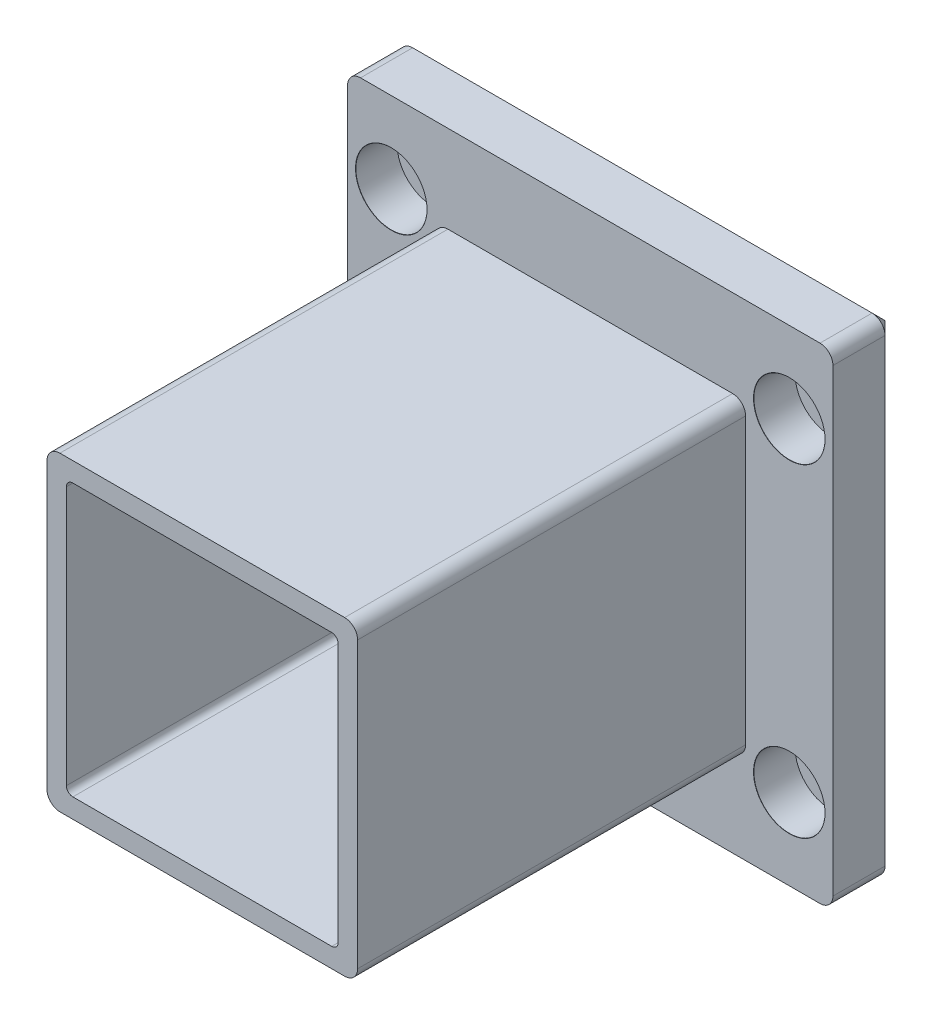
from build123d import *

# Parameters (mm, degrees)
SKETCH1_W                                    = 48
SKETCH1_H                                    = 48
SKETCH1_W_2                                  = 42
SKETCH1_H_2                                  = 42
BOSS_EXTRUDE1_DEPTH                          = 65
SKETCH3_W                                    = 75
SKETCH3_H                                    = 75
BOSS_EXTRUDE2_DEPTH                          = 5
SKETCH8_W                                    = 75
SKETCH8_H                                    = 75
SKETCH8_W_2                                  = 42
SKETCH8_H_2                                  = 42
BOSS_EXTRUDE3_DEPTH                          = 5.047079132
FILLET1_R                                    = 2
CBORE_FOR_M6_HEX_SOCKET_HEAD_CAP_SCR_2_COUNT = 2
CBORE_FOR_M6_HEX_SOCKET_HEAD_CAP_SCR_2_PITCH = 50
CBORE_FOR_M6_HEX_SOCKET_HEAD_CAP_SCR_3_COUNT = 2
CBORE_FOR_M6_HEX_SOCKET_HEAD_CAP_SCR_3_PITCH = 61.5
CBORE_FOR_M6_HEX_SOCKET_HEAD_CAP_SCR_4_COUNT = 2
CBORE_FOR_M6_HEX_SOCKET_HEAD_CAP_SCR_4_PITCH = 79.260645973
FILLET2_R                                    = 1
CHAMFER1_SIZE                                = 2


with BuildPart() as part:
    # Sketch1 → Boss-Extrude1 (new body)
    with BuildSketch(Plane(origin=(0, 0, 0), x_dir=(0, 1, 0), z_dir=(0, 0, 1))):
        with Locations((-1.048003873, 6.146094376)):
            Rectangle(SKETCH1_W, SKETCH1_H)
        with Locations((-1.048003873, 6.146094376)):
            Rectangle(SKETCH1_W_2, SKETCH1_H_2, mode=Mode.SUBTRACT)
    extrude(amount=BOSS_EXTRUDE1_DEPTH)

    # Sketch3 → Boss-Extrude2 (add)
    with BuildSketch(Plane(origin=(0, 0, 0), x_dir=(1, 0, 0), z_dir=(0, 0, -1))):
        with Locations((-6.146094376, 1.048003873)):
            Rectangle(SKETCH3_W, SKETCH3_H)
    extrude(amount=BOSS_EXTRUDE2_DEPTH)

    # Sketch8 → Boss-Extrude3 (add)
    with BuildSketch(Plane.XY):
        with Locations((-6.146094376, -1.048003873)):
            Rectangle(SKETCH8_W, SKETCH8_H)
        with Locations((-6.146094376, -1.048003873)):
            Rectangle(SKETCH8_W_2, SKETCH8_H_2, mode=Mode.SUBTRACT)
    extrude(amount=BOSS_EXTRUDE3_DEPTH)

    # Fillet1
    fillet1_edges = [part.edges().sort_by_distance(p)[0] for p in [
        (17.853905624, 22.951996127, 35.023539566),
        (17.853905624, -25.048003873, 35.023539566),
        (-30.146094376, -25.048003873, 35.023539566),
        (-30.146094376, 22.951996127, 35.023539566),
        (-43.646094376, -38.548003873, 0.023539566),
        (31.353905624, -38.548003873, 0.023539566),
        (31.353905624, 36.451996127, 0.023539566),
        (-43.646094376, 36.451996127, 0.023539566),
    ]]
    fillet(fillet1_edges, radius=FILLET1_R)

    # Sketch15 → CBORE for M6 Hex Socket Head Cap Screw2 (revolve, cut)
    with BuildSketch(Plane(origin=(-36.896094376, 23.951996127, 5.047079132), x_dir=(0, -1, 0), z_dir=(1, 0, 0))):
        Polygon((0, 0), (0, 10.047079132), (3.3, 10.047079132), (3.3, 6.4), (5.5, 6.4), (5.5, 0.025), (5.525, 0), align=None)
    cbore_for_m6_hex_socket_head_cap_screw2 = revolve(axis=Axis((-36.896094376, 23.951996127, 11.397079132), (0, 0, -1)), mode=Mode.SUBTRACT)

    # CBORE for M6 Hex Socket Head Cap Scr 2: CBORE for M6 Hex Socket Head Cap Screw2 ×2
    with Locations(*[(0, -i * CBORE_FOR_M6_HEX_SOCKET_HEAD_CAP_SCR_2_PITCH, 0) for i in range(1, CBORE_FOR_M6_HEX_SOCKET_HEAD_CAP_SCR_2_COUNT)]):
        add(cbore_for_m6_hex_socket_head_cap_screw2, mode=Mode.SUBTRACT)

    # CBORE for M6 Hex Socket Head Cap Scr 3: CBORE for M6 Hex Socket Head Cap Screw2 ×2
    with Locations(*[(i * CBORE_FOR_M6_HEX_SOCKET_HEAD_CAP_SCR_3_PITCH, 0, 0) for i in range(1, CBORE_FOR_M6_HEX_SOCKET_HEAD_CAP_SCR_3_COUNT)]):
        add(cbore_for_m6_hex_socket_head_cap_screw2, mode=Mode.SUBTRACT)

    # CBORE for M6 Hex Socket Head Cap Scr 4: CBORE for M6 Hex Socket Head Cap Screw2 ×2
    with Locations(*[Vector(0.7759210039901774, -0.63083008454486, 0) * (i * CBORE_FOR_M6_HEX_SOCKET_HEAD_CAP_SCR_4_PITCH) for i in range(1, CBORE_FOR_M6_HEX_SOCKET_HEAD_CAP_SCR_4_COUNT)]):
        add(cbore_for_m6_hex_socket_head_cap_screw2, mode=Mode.SUBTRACT)

    # Fillet2
    fillet2_edges = [part.edges().sort_by_distance(p)[0] for p in [
        (14.853905624, -22.048003873, 32.5),
        (14.853905624, 19.951996127, 32.5),
        (-27.146094376, 19.951996127, 32.5),
        (-27.146094376, -22.048003873, 32.5),
    ]]
    fillet(fillet2_edges, radius=FILLET2_R)

    # Chamfer1
    chamfer1_edges = [part.edges().sort_by_distance(p)[0] for p in [
        (-6.146094376, 36.451996127, -5),
        (-6.146094376, -38.548003873, -5),
        (-43.646094376, -1.048003873, -5),
        (30.768119187, -37.962217436, -5),
        (-43.060307938, -37.962217436, -5),
        (-43.060307938, 35.866209689, -5),
        (30.768119187, 35.866209689, -5),
        (31.353905624, -1.048003873, -5),
    ]]
    chamfer(chamfer1_edges, length=CHAMFER1_SIZE)


solid = part.part
